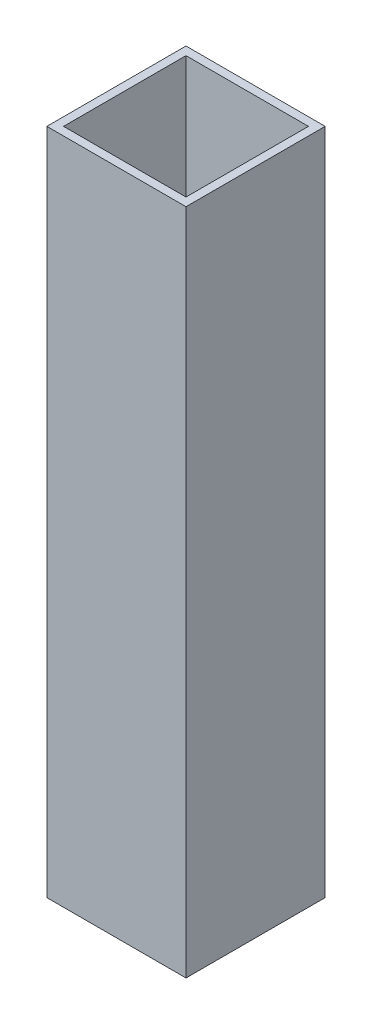
from build123d import *

# Parameters (mm, degrees)
BOSS_EXTRUDE1_DEPTH      = 60
BOSS_EXTRUDE1_DEPTH_BACK = 60
SKETCH1_W                = 25
SKETCH1_H                = 25
SKETCH1_W_2              = 22
SKETCH1_H_2              = 22


with BuildPart() as part:
    # Sketch1 → Boss-Extrude1 (new, two sides: drawn at the far end of the back side and taken through both)
    with BuildSketch(Plane(origin=(0, 0, 0), x_dir=(1, 0, 0), z_dir=(0, 1, 0)).offset(-BOSS_EXTRUDE1_DEPTH_BACK)):
        Rectangle(SKETCH1_W, SKETCH1_H)
        Rectangle(SKETCH1_W_2, SKETCH1_H_2, mode=Mode.SUBTRACT)
    extrude(amount=BOSS_EXTRUDE1_DEPTH + BOSS_EXTRUDE1_DEPTH_BACK)


solid = part.part
